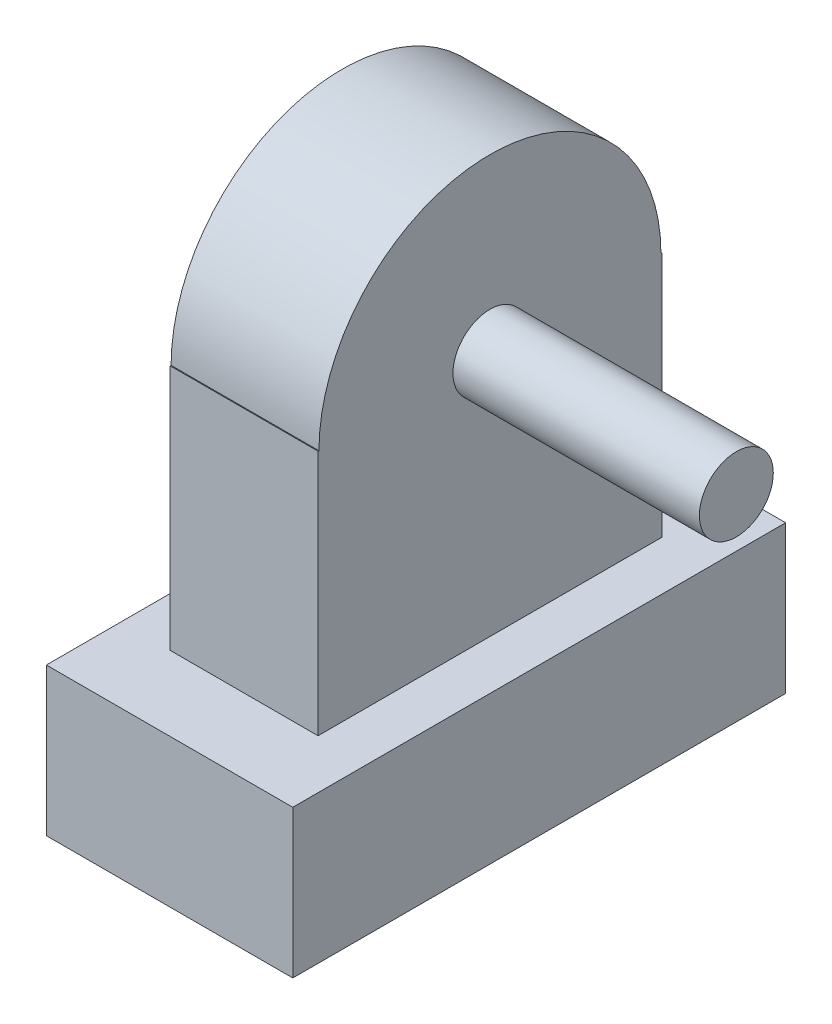
from build123d import *

# Parameters (mm, degrees)
SKETCH1_W           = 50
SKETCH1_H           = 100
BOSS_EXTRUDE1_DEPTH = 30
SKETCH3_W           = 30
SKETCH3_H           = 69.741989622
BOSS_EXTRUDE2_DEPTH = 50
SKETCH4_R           = 34.693390841
BOSS_EXTRUDE3_DEPTH = 30
SKETCH6_R           = 7.5
BOSS_EXTRUDE4_DEPTH = 50


with BuildPart() as part:
    # Sketch1 → Boss-Extrude1 (new body)
    with BuildSketch(Plane(origin=(0, 0, 0), x_dir=(1, 0, 0), z_dir=(0, 1, 0))):
        Rectangle(SKETCH1_W, SKETCH1_H)
    extrude(amount=BOSS_EXTRUDE1_DEPTH)

    # Sketch3 → Boss-Extrude2 (add)
    with BuildSketch(Plane(origin=(0, 30, 0), x_dir=(1, 0, 0), z_dir=(0, 1, 0))):
        Rectangle(SKETCH3_W, SKETCH3_H)
    extrude(amount=BOSS_EXTRUDE2_DEPTH)

    # Sketch4 → Boss-Extrude3 (add)
    with BuildSketch(Plane(origin=(15, 0, 0), x_dir=(0, 0, -1), z_dir=(1, 0, 0))):
        with Locations((0, 80)):
            Circle(SKETCH4_R)
    extrude(amount=-BOSS_EXTRUDE3_DEPTH)

    # Sketch6 → Boss-Extrude4 (add)
    with BuildSketch(Plane(origin=(15, 0, 0), x_dir=(0, 0, -1), z_dir=(1, 0, 0))):
        with Locations(Location((0, 80, 0), (0, 0, 180))):
            Circle(SKETCH6_R)
    extrude(amount=BOSS_EXTRUDE4_DEPTH)


solid = part.part
